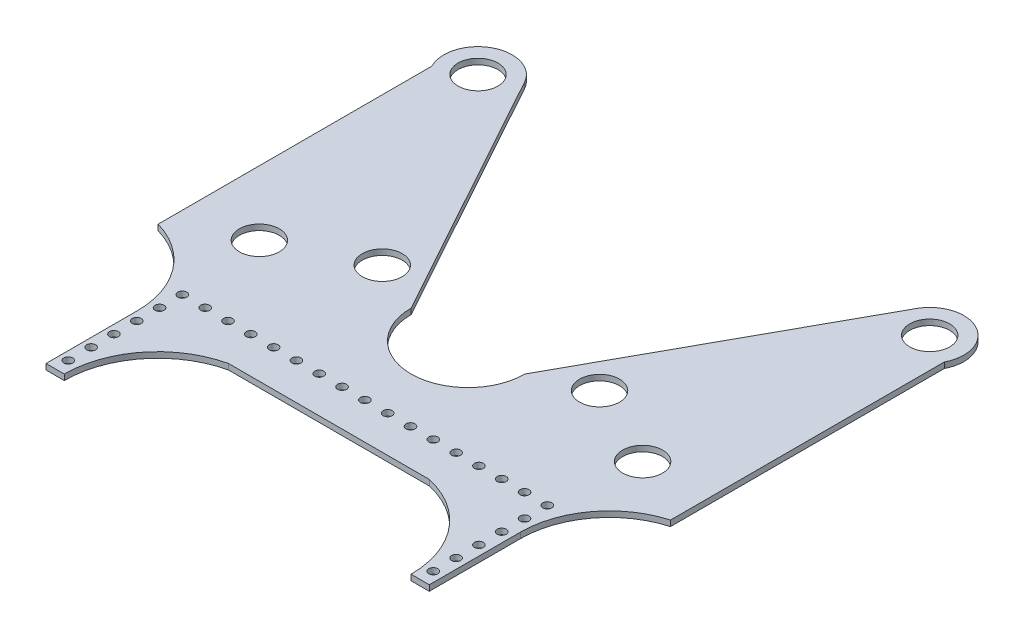
from build123d import *

# Parameters (mm, degrees)
SKETCH1_R           = 11.1125
SKETCH1_R_2         = 2.4892
BOSS_EXTRUDE1_DEPTH = 3.175


with BuildPart() as part:
    # Sketch1 → Boss-Extrude1 (new body)
    with BuildSketch(Plane(origin=(0, 0, 0), x_dir=(1, 0, 0), z_dir=(0, 1, 0))):
        with BuildLine():
            Line((142.632381685, 111.984564783), (142.632381685, -40.415435217))
            ThreePointArc((142.632381685, -40.415435217), (116.6794163, -58.165823863), (106.68, -87.975962792))
            Line((106.68, -87.975962792), (106.68, -138.775962792))
            Line((106.68, -138.775962792), (96.52, -138.775962792))
            ThreePointArc((96.52, -138.775962792), (85.109838908, -106.248091666), (55.88, -87.975962792))
            Line((55.88, -87.975962792), (-55.88, -87.975962792))
            ThreePointArc((-55.88, -87.975962792), (-85.109838908, -106.248091666), (-96.52, -138.775962792))
            Line((-96.52, -138.775962792), (-106.68, -138.775962792))
            Line((-106.68, -138.775962792), (-106.68, -87.975962792))
            ThreePointArc((-106.68, -87.975962792), (-116.6794163, -58.165823863), (-142.632381685, -40.415435217))
            Line((-142.632381685, -40.415435217), (-142.632381685, 111.984564783))
            ThreePointArc((-142.632381685, 111.984564783), (-134.600001748, 137.62278551), (-108.918256202, 129.730673295))
            Line((-108.918256202, 129.730673295), (-31.75, -10.478375174))
            ThreePointArc((-31.75, -10.478375174), (0, -42.228375174), (31.75, -10.478375174))
            Line((31.75, -10.478375174), (108.918256202, 129.730673295))
            ThreePointArc((108.918256202, 129.730673295), (134.600001748, 137.62278551), (142.632381685, 111.984564783))
        make_face()
        with Locations(Location((-60.484532313, 2.221624826, 0), (0, 0, 270))):
            Circle(SKETCH1_R, mode=Mode.SUBTRACT)
        with Locations(Location((-125.726814921, 120.76547091, 0), (0, 0, 270))):
            Circle(SKETCH1_R, mode=Mode.SUBTRACT)
        with Locations(Location((125.726814921, 120.76547091, 0), (0, 0, 270))):
            Circle(SKETCH1_R, mode=Mode.SUBTRACT)
        with Locations(Location((-101.9175, -67.628375174, 0), (0, 0, 270))):
            Circle(SKETCH1_R_2, mode=Mode.SUBTRACT)
        with Locations(Location((60.484532313, 2.221624826, 0), (0, 0, 270))):
            Circle(SKETCH1_R, mode=Mode.SUBTRACT)
        with Locations(Location((-89.2175, -67.628375174, 0), (0, 0, 270))):
            Circle(SKETCH1_R_2, mode=Mode.SUBTRACT)
        with Locations(Location((-76.5175, -67.628375174, 0), (0, 0, 270))):
            Circle(SKETCH1_R_2, mode=Mode.SUBTRACT)
        with Locations(Location((-63.8175, -67.628375174, 0), (0, 0, 270))):
            Circle(SKETCH1_R_2, mode=Mode.SUBTRACT)
        with Locations(Location((-51.1175, -67.628375174, 0), (0, 0, 270))):
            Circle(SKETCH1_R_2, mode=Mode.SUBTRACT)
        with Locations(Location((-38.4175, -67.628375174, 0), (0, 0, 270))):
            Circle(SKETCH1_R_2, mode=Mode.SUBTRACT)
        with Locations(Location((-25.7175, -67.628375174, 0), (0, 0, 270))):
            Circle(SKETCH1_R_2, mode=Mode.SUBTRACT)
        with Locations(Location((-13.0175, -67.628375174, 0), (0, 0, 270))):
            Circle(SKETCH1_R_2, mode=Mode.SUBTRACT)
        with Locations(Location((-0.3175, -67.628375174, 0), (0, 0, 270))):
            Circle(SKETCH1_R_2, mode=Mode.SUBTRACT)
        with Locations(Location((12.3825, -67.628375174, 0), (0, 0, 270))):
            Circle(SKETCH1_R_2, mode=Mode.SUBTRACT)
        with Locations(Location((25.0825, -67.628375174, 0), (0, 0, 270))):
            Circle(SKETCH1_R_2, mode=Mode.SUBTRACT)
        with Locations(Location((37.7825, -67.628375174, 0), (0, 0, 270))):
            Circle(SKETCH1_R_2, mode=Mode.SUBTRACT)
        with Locations(Location((50.4825, -67.628375174, 0), (0, 0, 270))):
            Circle(SKETCH1_R_2, mode=Mode.SUBTRACT)
        with Locations(Location((63.1825, -67.628375174, 0), (0, 0, 270))):
            Circle(SKETCH1_R_2, mode=Mode.SUBTRACT)
        with Locations(Location((75.8825, -67.628375174, 0), (0, 0, 270))):
            Circle(SKETCH1_R_2, mode=Mode.SUBTRACT)
        with Locations(Location((88.5825, -67.628375174, 0), (0, 0, 270))):
            Circle(SKETCH1_R_2, mode=Mode.SUBTRACT)
        with Locations(Location((101.2825, -67.628375174, 0), (0, 0, 270))):
            Circle(SKETCH1_R_2, mode=Mode.SUBTRACT)
        with Locations(Location((-101.9175, -80.328375174, 0), (0, 0, 270))):
            Circle(SKETCH1_R_2, mode=Mode.SUBTRACT)
        with Locations(Location((-101.9175, -93.028375174, 0), (0, 0, 270))):
            Circle(SKETCH1_R_2, mode=Mode.SUBTRACT)
        with Locations(Location((-101.9175, -105.728375174, 0), (0, 0, 270))):
            Circle(SKETCH1_R_2, mode=Mode.SUBTRACT)
        with Locations(Location((-101.9175, -118.428375174, 0), (0, 0, 270))):
            Circle(SKETCH1_R_2, mode=Mode.SUBTRACT)
        with Locations(Location((-101.9175, -131.128375174, 0), (0, 0, 270))):
            Circle(SKETCH1_R_2, mode=Mode.SUBTRACT)
        with Locations(Location((101.2825, -80.328375174, 0), (0, 0, 270))):
            Circle(SKETCH1_R_2, mode=Mode.SUBTRACT)
        with Locations(Location((101.2825, -93.028375174, 0), (0, 0, 270))):
            Circle(SKETCH1_R_2, mode=Mode.SUBTRACT)
        with Locations(Location((101.2825, -105.728375174, 0), (0, 0, 270))):
            Circle(SKETCH1_R_2, mode=Mode.SUBTRACT)
        with Locations(Location((101.2825, -118.428375174, 0), (0, 0, 270))):
            Circle(SKETCH1_R_2, mode=Mode.SUBTRACT)
        with Locations(Location((101.2825, -131.128375174, 0), (0, 0, 270))):
            Circle(SKETCH1_R_2, mode=Mode.SUBTRACT)
        with Locations(Location((-106.68, -20.003375174, 0), (0, 0, 270))):
            Circle(SKETCH1_R, mode=Mode.SUBTRACT)
        with Locations(Location((106.68, -20.003375174, 0), (0, 0, 270))):
            Circle(SKETCH1_R, mode=Mode.SUBTRACT)
    extrude(amount=BOSS_EXTRUDE1_DEPTH)


solid = part.part
